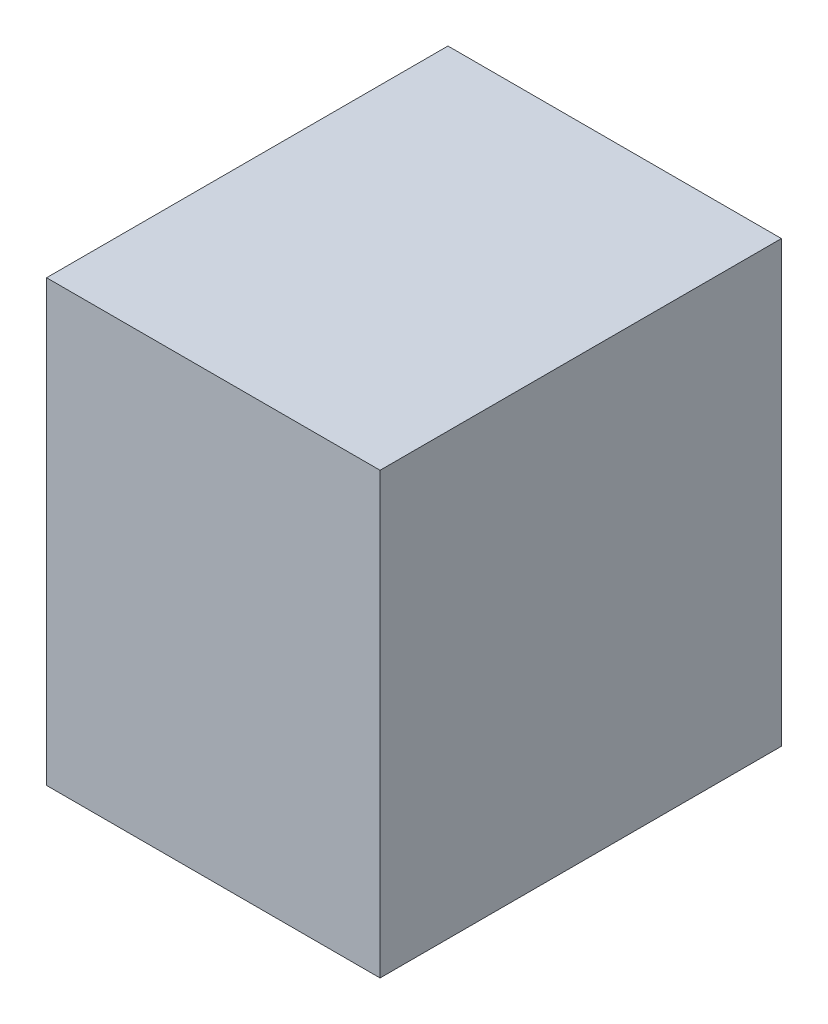
from build123d import *

# Parameters (mm, degrees)
SKETCH1_W           = 113
SKETCH1_H           = 136
BOSS_EXTRUDE1_DEPTH = 74.5


with BuildPart() as part:
    # Sketch1 → Boss-Extrude1 (new, symmetric)
    with BuildSketch(Plane(origin=(0, 0, 0), x_dir=(1, 0, 0), z_dir=(0, 1, 0))):
        Rectangle(SKETCH1_W, SKETCH1_H)
    extrude(amount=BOSS_EXTRUDE1_DEPTH, both=True)


solid = part.part
